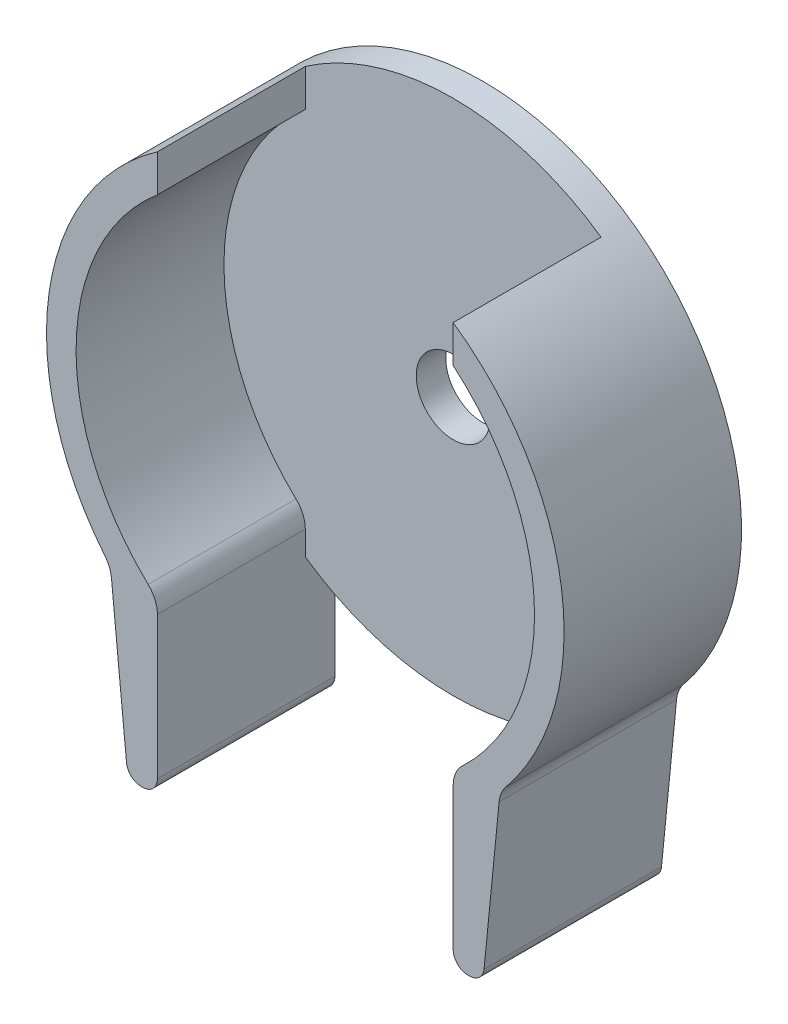
from build123d import *

# Parameters (mm, degrees)
SKETCH1_R               = 17.5
BOSS_EXTRUDE1_DEPTH     = 12
SHELL4_T                = -2
CUT_EXTRUDE1_DEPTH      = 28.504545079
CUT_EXTRUDE1_DEPTH_BACK = 28.504545079
SKETCH3_R               = 2.5
CUT_EXTRUDE2_DEPTH      = 28.504545079
CUT_EXTRUDE2_DEPTH_BACK = 28.504545079
SKETCH4_W               = 20
SKETCH4_H               = 24.94066955
BOSS_EXTRUDE2_DEPTH     = 12
FILLET1_R               = 2
FILLET2_R               = 2
FILLET5_R               = 1


with BuildPart() as part:
    # Sketch1 → Boss-Extrude1 (new body)
    with BuildSketch(Plane.XY):
        Circle(SKETCH1_R)
    extrude(amount=BOSS_EXTRUDE1_DEPTH)

    # Shell4
    shell4_openings = [part.faces().sort_by_distance(p)[0] for p in [
        (0, 0, 12),
    ]]
    offset(amount=SHELL4_T, openings=shell4_openings, kind=Kind.INTERSECTION)

    # Sketch3 → Cut-Extrude1 (cut, two sides: drawn at the far end of the back side and taken through both)
    with BuildSketch(Plane.XY.offset(-CUT_EXTRUDE1_DEPTH_BACK)):
        Circle(SKETCH3_R)
    extrude(amount=CUT_EXTRUDE1_DEPTH + CUT_EXTRUDE1_DEPTH_BACK, mode=Mode.SUBTRACT)

    # Sketch4 → Cut-Extrude2 (cut, two sides: drawn at the far end of the back side and taken through both)
    with BuildSketch(Plane(origin=(0, 0, 0), x_dir=(1, 0, 0), z_dir=(0, 1, 0)).offset(-CUT_EXTRUDE2_DEPTH_BACK)):
        with Locations((0, -14.470334775)):
            Rectangle(SKETCH4_W, SKETCH4_H)
    extrude(amount=CUT_EXTRUDE2_DEPTH + CUT_EXTRUDE2_DEPTH_BACK, mode=Mode.SUBTRACT)

    # Sketch7 → Boss-Extrude2 (add)
    with BuildSketch(Plane.XY.offset(12)):
        Polygon((-10, -14.361406616), (-10, -23.35781655), (-12, -23.35781655), (-13.169286174, -11.524751697), align=None)
        Polygon((10, -14.361406616), (10, -23.35781655), (12, -23.35781655), (13.169286174, -11.524751697), align=None)
    extrude(amount=-BOSS_EXTRUDE2_DEPTH)

    # Fillet1
    fillet1_edges = [part.edges().sort_by_distance(p)[0] for p in [
        (-10, -11.842719282, 7),
        (10, -11.842719282, 7),
    ]]
    fillet(fillet1_edges, radius=FILLET1_R)

    # Fillet2
    fillet2_edges = [part.edges().sort_by_distance(p)[0] for p in [
        (-13.169286174, -11.524751697, 6),
        (13.169286174, -11.524751697, 6),
    ]]
    fillet(fillet2_edges, radius=FILLET2_R)

    # Fillet5
    fillet5_edges = [part.edges().sort_by_distance(p)[0] for p in [
        (-10, -23.35781655, 6),
        (-12, -23.35781655, 6),
        (12, -23.35781655, 6),
        (10, -23.35781655, 6),
    ]]
    fillet(fillet5_edges, radius=FILLET5_R)


solid = part.part
